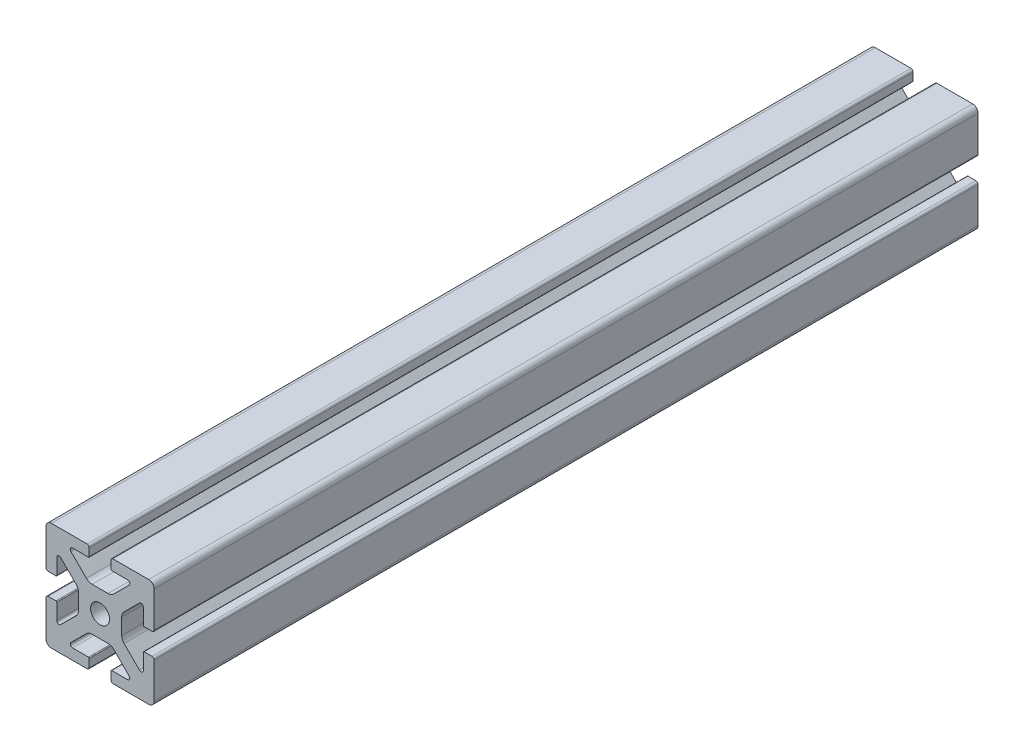
from build123d import *

# Parameters (mm, degrees)
BOSS_EXTRUDE1_DEPTH      = 152.4
BOSS_EXTRUDE1_DEPTH_BACK = 152.4
SKETCH3_R                = 3.5


with BuildPart() as part:
    # Sketch3 → Boss-Extrude1 (new, two sides: drawn at the far end of the back side and taken through both)
    with BuildSketch(Plane.XY.offset(-BOSS_EXTRUDE1_DEPTH_BACK)):
        with BuildLine():
            Line((4.7874, 20), (18, 20))
            ThreePointArc((18, 20), (19.414213562, 19.414213562), (20, 18))
            Line((20, 18), (20, 4.7874))
            ThreePointArc((20, 4.7874), (19.76937588, 4.23062412), (19.2126, 4))
            Line((19.2126, 4), (16.3048, 4))
            ThreePointArc((16.3048, 4), (16.089273853, 4.089273853), (16, 4.3048))
            Line((16, 4.3048), (16, 10.1618))
            ThreePointArc((16, 10.1618), (15.482565253, 10.936195824), (14.569103096, 10.754496904))
            Line((14.569103096, 10.754496904), (8.878679656, 5.064073464))
            ThreePointArc((8.878679656, 5.064073464), (8.228361402, 4.090803418), (8, 2.942753121))
            Line((8, 2.942753121), (8, -2.942753121))
            ThreePointArc((8, -2.942753121), (8.228361402, -4.090803418), (8.878679656, -5.064073464))
            Line((8.878679656, -5.064073464), (14.569103096, -10.754496904))
            ThreePointArc((14.569103096, -10.754496904), (15.482565253, -10.936195824), (16, -10.1618))
            Line((16, -10.1618), (16, -4.3048))
            ThreePointArc((16, -4.3048), (16.089273853, -4.089273853), (16.3048, -4))
            Line((16.3048, -4), (19.2126, -4))
            ThreePointArc((19.2126, -4), (19.76937588, -4.23062412), (20, -4.7874))
            Line((20, -4.7874), (20, -18))
            ThreePointArc((20, -18), (19.414213562, -19.414213562), (18, -20))
            Line((18, -20), (4.7874, -20))
            ThreePointArc((4.7874, -20), (4.23062412, -19.76937588), (4, -19.2126))
            Line((4, -19.2126), (4, -16.3048))
            ThreePointArc((4, -16.3048), (4.089273853, -16.089273853), (4.3048, -16))
            Line((4.3048, -16), (10.1618, -16))
            ThreePointArc((10.1618, -16), (10.936195824, -15.482565253), (10.754496904, -14.569103096))
            Line((10.754496904, -14.569103096), (5.064073464, -8.878679656))
            ThreePointArc((5.064073464, -8.878679656), (4.090803418, -8.228361402), (2.942753121, -8))
            Line((2.942753121, -8), (-2.942753121, -8))
            ThreePointArc((-2.942753121, -8), (-4.090803418, -8.228361402), (-5.064073464, -8.878679656))
            Line((-5.064073464, -8.878679656), (-10.754496904, -14.569103096))
            ThreePointArc((-10.754496904, -14.569103096), (-10.936195824, -15.482565253), (-10.1618, -16))
            Line((-10.1618, -16), (-4.3048, -16))
            ThreePointArc((-4.3048, -16), (-4.089273853, -16.089273853), (-4, -16.3048))
            Line((-4, -16.3048), (-4, -19.2126))
            ThreePointArc((-4, -19.2126), (-4.23062412, -19.76937588), (-4.7874, -20))
            Line((-4.7874, -20), (-18, -20))
            ThreePointArc((-18, -20), (-19.414213562, -19.414213562), (-20, -18))
            Line((-20, -18), (-20, -4.7874))
            ThreePointArc((-20, -4.7874), (-19.76937588, -4.23062412), (-19.2126, -4))
            Line((-19.2126, -4), (-16.3048, -4))
            ThreePointArc((-16.3048, -4), (-16.089273853, -4.089273853), (-16, -4.3048))
            Line((-16, -4.3048), (-16, -10.1618))
            ThreePointArc((-16, -10.1618), (-15.482565253, -10.936195824), (-14.569103096, -10.754496904))
            Line((-14.569103096, -10.754496904), (-8.878679656, -5.064073464))
            ThreePointArc((-8.878679656, -5.064073464), (-8.228361402, -4.090803418), (-8, -2.942753121))
            Line((-8, -2.942753121), (-8, 2.942753121))
            ThreePointArc((-8, 2.942753121), (-8.228361402, 4.090803418), (-8.878679656, 5.064073464))
            Line((-8.878679656, 5.064073464), (-14.569103096, 10.754496904))
            ThreePointArc((-14.569103096, 10.754496904), (-15.482565253, 10.936195824), (-16, 10.1618))
            Line((-16, 10.1618), (-16, 4.3048))
            ThreePointArc((-16, 4.3048), (-16.089273853, 4.089273853), (-16.3048, 4))
            Line((-16.3048, 4), (-19.2126, 4))
            ThreePointArc((-19.2126, 4), (-19.76937588, 4.23062412), (-20, 4.7874))
            Line((-20, 4.7874), (-20, 18))
            ThreePointArc((-20, 18), (-19.414213562, 19.414213562), (-18, 20))
            Line((-18, 20), (-4.7874, 20))
            ThreePointArc((-4.7874, 20), (-4.23062412, 19.76937588), (-4, 19.2126))
            Line((-4, 19.2126), (-4, 16.3048))
            ThreePointArc((-4, 16.3048), (-4.089273853, 16.089273853), (-4.3048, 16))
            Line((-4.3048, 16), (-10.1618, 16))
            ThreePointArc((-10.1618, 16), (-10.936195824, 15.482565253), (-10.754496904, 14.569103096))
            Line((-10.754496904, 14.569103096), (-5.064073464, 8.878679656))
            ThreePointArc((-5.064073464, 8.878679656), (-4.090803418, 8.228361402), (-2.942753121, 8))
            Line((-2.942753121, 8), (2.942753121, 8))
            ThreePointArc((2.942753121, 8), (4.090803418, 8.228361402), (5.064073464, 8.878679656))
            Line((5.064073464, 8.878679656), (10.754496904, 14.569103096))
            ThreePointArc((10.754496904, 14.569103096), (10.936195824, 15.482565253), (10.1618, 16))
            Line((10.1618, 16), (4.3048, 16))
            ThreePointArc((4.3048, 16), (4.089273853, 16.089273853), (4, 16.3048))
            Line((4, 16.3048), (4, 19.2126))
            ThreePointArc((4, 19.2126), (4.23062412, 19.76937588), (4.7874, 20))
        make_face()
        with Locations(Location((0, 0, 0), (0, 0, 180))):
            Circle(SKETCH3_R, mode=Mode.SUBTRACT)
    extrude(amount=BOSS_EXTRUDE1_DEPTH + BOSS_EXTRUDE1_DEPTH_BACK)


solid = part.part
